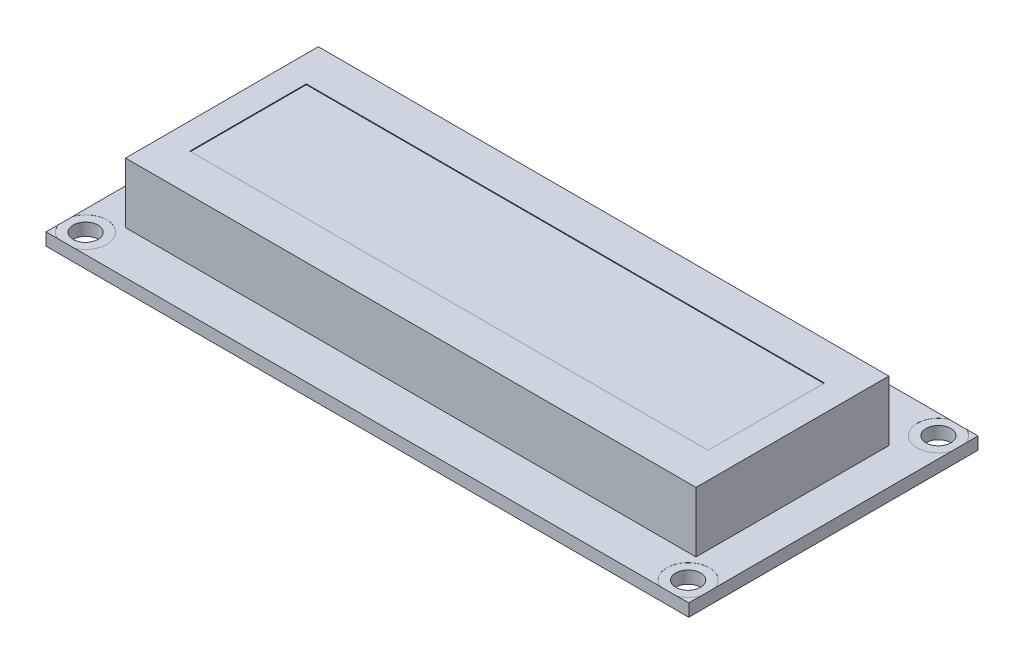
from build123d import *

# Parameters (mm, degrees)
SKETCH1_W            = 80
SKETCH1_H            = 36
PCB_DEPTH            = 1.55
SKETCH2_R            = 1.55
MOUNTINGHOLES_DEPTH  = 44.890801998
SKETCH3_R            = 2.65
PADS_DEPTH           = 0.01
SKETCH4_R            = 0.5
CONNECTERHOLES_DEPTH = 44.890801998
SKETCH5_W            = 71
SKETCH5_H            = 24
PANELBODY_DEPTH      = 7.5
SKETCH6_W            = 64.5
SKETCH6_H            = 14.5
SCREEN_DEPTH         = 0.1


with BuildPart() as part:
    # Sketch1 → PCB (new body)
    with BuildSketch(Plane(origin=(0, 0, 0), x_dir=(1, 0, 0), z_dir=(0, 1, 0))):
        Rectangle(SKETCH1_W, SKETCH1_H)
    extrude(amount=PCB_DEPTH)

    # Sketch2 → MountingHoles (cut, through all)
    with BuildSketch(Plane(origin=(0, 1.55, 0), x_dir=(1, 0, 0), z_dir=(0, 1, 0))):
        with Locations(Location((-37.5, 15.575, 0), (0, 0, 270))):
            Circle(SKETCH2_R)
        with Locations(Location((37.5, 15.575, 0), (0, 0, 270))):
            Circle(SKETCH2_R)
        with Locations(Location((37.5, -15.575, 0), (0, 0, 270))):
            Circle(SKETCH2_R)
        with Locations(Location((-37.5, -15.575, 0), (0, 0, 270))):
            Circle(SKETCH2_R)
    extrude(amount=-MOUNTINGHOLES_DEPTH, mode=Mode.SUBTRACT)

    # Sketch3 → Pads (cut)
    with BuildSketch(Plane(origin=(0, 1.55, 0), x_dir=(1, 0, 0), z_dir=(0, 1, 0))):
        with Locations((-37.5, 15.575)):
            Circle(SKETCH3_R)
        with Locations((37.5, 15.575)):
            Circle(SKETCH3_R)
        with Locations((37.5, -15.575)):
            Circle(SKETCH3_R)
        with Locations((-37.5, -15.575)):
            Circle(SKETCH3_R)
        with BuildLine():
            Line((-32.9, 18), (-31.1, 18))
            Line((-31.1, 18), (-31.1, 16))
            ThreePointArc((-31.1, 16), (-32, 15.1), (-32.9, 16))
            Line((-32.9, 16), (-32.9, 18))
        make_face()
        with BuildLine():
            Line((-30.36, 18), (-30.36, 16))
            ThreePointArc((-30.36, 16), (-29.46, 15.1), (-28.56, 16))
            Line((-28.56, 16), (-28.56, 18))
            Line((-28.56, 18), (-30.36, 18))
        make_face()
        with BuildLine():
            Line((-27.82, 18), (-27.82, 16))
            ThreePointArc((-27.82, 16), (-26.92, 15.1), (-26.02, 16))
            Line((-26.02, 16), (-26.02, 18))
            Line((-26.02, 18), (-27.82, 18))
        make_face()
        with BuildLine():
            Line((-25.28, 18), (-25.28, 16))
            ThreePointArc((-25.28, 16), (-24.38, 15.1), (-23.48, 16))
            Line((-23.48, 16), (-23.48, 18))
            Line((-23.48, 18), (-25.28, 18))
        make_face()
        with BuildLine():
            Line((-22.74, 18), (-22.74, 16))
            ThreePointArc((-22.74, 16), (-21.84, 15.1), (-20.94, 16))
            Line((-20.94, 16), (-20.94, 18))
            Line((-20.94, 18), (-22.74, 18))
        make_face()
        with BuildLine():
            Line((-20.2, 18), (-20.2, 16))
            ThreePointArc((-20.2, 16), (-19.3, 15.1), (-18.4, 16))
            Line((-18.4, 16), (-18.4, 18))
            Line((-18.4, 18), (-20.2, 18))
        make_face()
        with BuildLine():
            Line((-17.66, 18), (-17.66, 16))
            ThreePointArc((-17.66, 16), (-16.76, 15.1), (-15.86, 16))
            Line((-15.86, 16), (-15.86, 18))
            Line((-15.86, 18), (-17.66, 18))
        make_face()
        with BuildLine():
            Line((-15.12, 18), (-15.12, 16))
            ThreePointArc((-15.12, 16), (-14.22, 15.1), (-13.32, 16))
            Line((-13.32, 16), (-13.32, 18))
            Line((-13.32, 18), (-15.12, 18))
        make_face()
        with BuildLine():
            Line((-12.58, 18), (-12.58, 16))
            ThreePointArc((-12.58, 16), (-11.68, 15.1), (-10.78, 16))
            Line((-10.78, 16), (-10.78, 18))
            Line((-10.78, 18), (-12.58, 18))
        make_face()
        with BuildLine():
            Line((-10.04, 18), (-10.04, 16))
            ThreePointArc((-10.04, 16), (-9.14, 15.1), (-8.24, 16))
            Line((-8.24, 16), (-8.24, 18))
            Line((-8.24, 18), (-10.04, 18))
        make_face()
        with BuildLine():
            Line((-7.5, 18), (-7.5, 16))
            ThreePointArc((-7.5, 16), (-6.6, 15.1), (-5.7, 16))
            Line((-5.7, 16), (-5.7, 18))
            Line((-5.7, 18), (-7.5, 18))
        make_face()
        with BuildLine():
            Line((-4.96, 18), (-4.96, 16))
            ThreePointArc((-4.96, 16), (-4.06, 15.1), (-3.16, 16))
            Line((-3.16, 16), (-3.16, 18))
            Line((-3.16, 18), (-4.96, 18))
        make_face()
        with BuildLine():
            Line((-2.42, 18), (-2.42, 16))
            ThreePointArc((-2.42, 16), (-1.52, 15.1), (-0.62, 16))
            Line((-0.62, 16), (-0.62, 18))
            Line((-0.62, 18), (-2.42, 18))
        make_face()
        with BuildLine():
            Line((0.12, 18), (0.12, 16))
            ThreePointArc((0.12, 16), (1.02, 15.1), (1.92, 16))
            Line((1.92, 16), (1.92, 18))
            Line((1.92, 18), (0.12, 18))
        make_face()
        with BuildLine():
            Line((2.66, 18), (2.66, 16))
            ThreePointArc((2.66, 16), (3.56, 15.1), (4.46, 16))
            Line((4.46, 16), (4.46, 18))
            Line((4.46, 18), (2.66, 18))
        make_face()
        with BuildLine():
            Line((5.2, 18), (5.2, 16))
            ThreePointArc((5.2, 16), (6.1, 15.1), (7, 16))
            Line((7, 16), (7, 18))
            Line((7, 18), (5.2, 18))
        make_face()
    extrude(amount=-PADS_DEPTH, mode=Mode.SUBTRACT)

    # Sketch4 → ConnecterHoles (cut, through all)
    with BuildSketch(Plane(origin=(0, 1.55, 0), x_dir=(1, 0, 0), z_dir=(0, 1, 0))):
        with Locations(Location((-32, 16, 0), (0, 0, 270))):
            Circle(SKETCH4_R)
        with Locations(Location((-29.46, 16, 0), (0, 0, 270))):
            Circle(SKETCH4_R)
        with Locations(Location((-26.92, 16, 0), (0, 0, 270))):
            Circle(SKETCH4_R)
        with Locations(Location((-24.38, 16, 0), (0, 0, 270))):
            Circle(SKETCH4_R)
        with Locations(Location((-21.84, 16, 0), (0, 0, 270))):
            Circle(SKETCH4_R)
        with Locations(Location((-19.3, 16, 0), (0, 0, 270))):
            Circle(SKETCH4_R)
        with Locations(Location((-16.76, 16, 0), (0, 0, 270))):
            Circle(SKETCH4_R)
        with Locations(Location((-14.22, 16, 0), (0, 0, 270))):
            Circle(SKETCH4_R)
        with Locations(Location((-11.68, 16, 0), (0, 0, 270))):
            Circle(SKETCH4_R)
        with Locations(Location((-9.14, 16, 0), (0, 0, 270))):
            Circle(SKETCH4_R)
        with Locations(Location((-6.6, 16, 0), (0, 0, 270))):
            Circle(SKETCH4_R)
        with Locations(Location((-4.06, 16, 0), (0, 0, 270))):
            Circle(SKETCH4_R)
        with Locations(Location((-1.52, 16, 0), (0, 0, 270))):
            Circle(SKETCH4_R)
        with Locations(Location((1.02, 16, 0), (0, 0, 270))):
            Circle(SKETCH4_R)
        with Locations(Location((3.56, 16, 0), (0, 0, 270))):
            Circle(SKETCH4_R)
        with Locations(Location((6.1, 16, 0), (0, 0, 270))):
            Circle(SKETCH4_R)
    extrude(amount=-CONNECTERHOLES_DEPTH, mode=Mode.SUBTRACT)

    # Sketch5 → PanelBody (add)
    with BuildSketch(Plane(origin=(0, 1.55, 0), x_dir=(1, 0, 0), z_dir=(0, 1, 0))):
        with Locations((0, -0.6)):
            Rectangle(SKETCH5_W, SKETCH5_H)
    extrude(amount=PANELBODY_DEPTH)

    # Sketch6 → Screen (cut)
    with BuildSketch(Plane(origin=(0, 9.05, 0), x_dir=(1, 0, 0), z_dir=(0, 1, 0))):
        with Locations((0, -0.6)):
            Rectangle(SKETCH6_W, SKETCH6_H)
    extrude(amount=-SCREEN_DEPTH, mode=Mode.SUBTRACT)


solid = part.part
